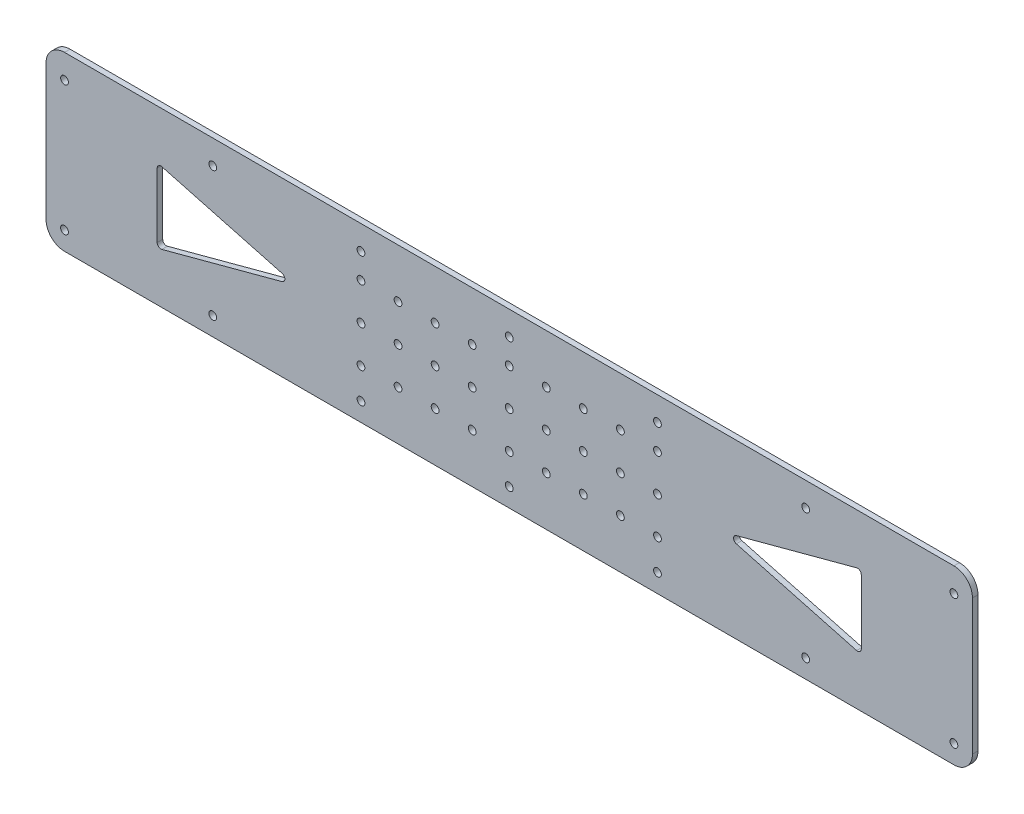
from build123d import *

# Parameters (mm, degrees)
SKETCH1_W           = 500
SKETCH1_H           = 93
BOSS_EXTRUDE1_DEPTH = 3
SKETCH2_R           = 2.1
CUT_EXTRUDE1_DEPTH  = 255.305426604
LPATTERN1_COUNT     = 2
LPATTERN1_PITCH     = 70
FILLET1_R           = 10
CUT_EXTRUDE2_DEPTH  = 255.305426604
SKETCH4_R           = 2.1
CUT_EXTRUDE3_DEPTH  = 255.305426604


with BuildPart() as part:
    # Sketch1 → Boss-Extrude1 (new body)
    with BuildSketch(Plane.XY):
        Rectangle(SKETCH1_W, SKETCH1_H)
    extrude(amount=BOSS_EXTRUDE1_DEPTH)

    # Sketch2 → Cut-Extrude1 (cut, through all)
    with BuildSketch(Plane.XY.offset(3)):
        with Locations((-240, 33.5)):
            Circle(SKETCH2_R)
        with Locations((-160, 33.5)):
            Circle(SKETCH2_R)
        with Locations((-80, 33.5)):
            Circle(SKETCH2_R)
        with Locations((0, 33.5)):
            Circle(SKETCH2_R)
        with Locations((80, 33.5)):
            Circle(SKETCH2_R)
        with Locations((160, 33.5)):
            Circle(SKETCH2_R)
        with Locations((240, 33.5)):
            Circle(SKETCH2_R)
    cut_extrude1 = extrude(amount=-CUT_EXTRUDE1_DEPTH, mode=Mode.SUBTRACT)

    # LPattern1: Cut-Extrude1 ×2
    with Locations(*[(0, -i * LPATTERN1_PITCH, 0) for i in range(1, LPATTERN1_COUNT)]):
        add(cut_extrude1, mode=Mode.SUBTRACT)

    # Fillet1
    fillet1_edges = [part.edges().sort_by_distance(p)[0] for p in [
        (250, -46.5, 1.5),
        (-250, -46.5, 1.5),
        (-250, 46.5, 1.5),
        (250, 46.5, 1.5),
    ]]
    fillet(fillet1_edges, radius=FILLET1_R)

    # Sketch3 → Cut-Extrude2 (cut, through all)
    with BuildSketch(Plane.XY.offset(3)):
        with BuildLine():
            Line((-190, -17.393549254), (-190, 17.393549254))
            ThreePointArc((-190, 17.393549254), (-189.217522858, 18.980255935), (-187.48236191, 19.325400907))
            Line((-187.48236191, 19.325400907), (-122.568752369, 1.931851653))
            ThreePointArc((-122.568752369, 1.931851653), (-121.086390459, 0), (-122.568752369, -1.931851653))
            Line((-122.568752369, -1.931851653), (-187.48236191, -19.325400907))
            ThreePointArc((-187.48236191, -19.325400907), (-189.217522858, -18.980255935), (-190, -17.393549254))
        make_face()
        with BuildLine():
            Line((190, -17.393549254), (190, 17.393549254))
            ThreePointArc((190, 17.393549254), (189.217522858, 18.980255935), (187.48236191, 19.325400907))
            Line((187.48236191, 19.325400907), (122.568752369, 1.931851653))
            ThreePointArc((122.568752369, 1.931851653), (121.086390459, 0), (122.568752369, -1.931851653))
            Line((122.568752369, -1.931851653), (187.48236191, -19.325400907))
            ThreePointArc((187.48236191, -19.325400907), (189.217522858, -18.980255935), (190, -17.393549254))
        make_face()
    extrude(amount=-CUT_EXTRUDE2_DEPTH, mode=Mode.SUBTRACT)

    # Sketch4 → Cut-Extrude3 (cut, through all)
    with BuildSketch(Plane.XY.offset(3)):
        with Locations((-80, 0)):
            Circle(SKETCH4_R)
        with Locations((-60, 0)):
            Circle(SKETCH4_R)
        with Locations((-40, 0)):
            Circle(SKETCH4_R)
        with Locations((-20, 0)):
            Circle(SKETCH4_R)
        Circle(SKETCH4_R)
        with Locations(Location((20, 0, 0), (0, 0, 180))):
            Circle(SKETCH4_R)
        with Locations(Location((40, 0, 0), (0, 0, 180))):
            Circle(SKETCH4_R)
        with Locations(Location((60, 0, 0), (0, 0, 180))):
            Circle(SKETCH4_R)
        with Locations(Location((80, 0, 0), (0, 0, 180))):
            Circle(SKETCH4_R)
        with Locations((-80, -20)):
            Circle(SKETCH4_R)
        with Locations((-60, -20)):
            Circle(SKETCH4_R)
        with Locations((-40, -20)):
            Circle(SKETCH4_R)
        with Locations((-20, -20)):
            Circle(SKETCH4_R)
        with Locations((0, -20)):
            Circle(SKETCH4_R)
        with Locations(Location((20, -20, 0), (0, 0, 180))):
            Circle(SKETCH4_R)
        with Locations(Location((40, -20, 0), (0, 0, 180))):
            Circle(SKETCH4_R)
        with Locations(Location((60, -20, 0), (0, 0, 180))):
            Circle(SKETCH4_R)
        with Locations(Location((80, -20, 0), (0, 0, 180))):
            Circle(SKETCH4_R)
        with Locations((80, 20)):
            Circle(SKETCH4_R)
        with Locations((60, 20)):
            Circle(SKETCH4_R)
        with Locations((40, 20)):
            Circle(SKETCH4_R)
        with Locations((20, 20)):
            Circle(SKETCH4_R)
        with Locations(Location((0, 20, 0), (0, 0, 180))):
            Circle(SKETCH4_R)
        with Locations(Location((-20, 20, 0), (0, 0, 180))):
            Circle(SKETCH4_R)
        with Locations(Location((-40, 20, 0), (0, 0, 180))):
            Circle(SKETCH4_R)
        with Locations(Location((-60, 20, 0), (0, 0, 180))):
            Circle(SKETCH4_R)
        with Locations(Location((-80, 20, 0), (0, 0, 180))):
            Circle(SKETCH4_R)
    extrude(amount=-CUT_EXTRUDE3_DEPTH, mode=Mode.SUBTRACT)


solid = part.part
